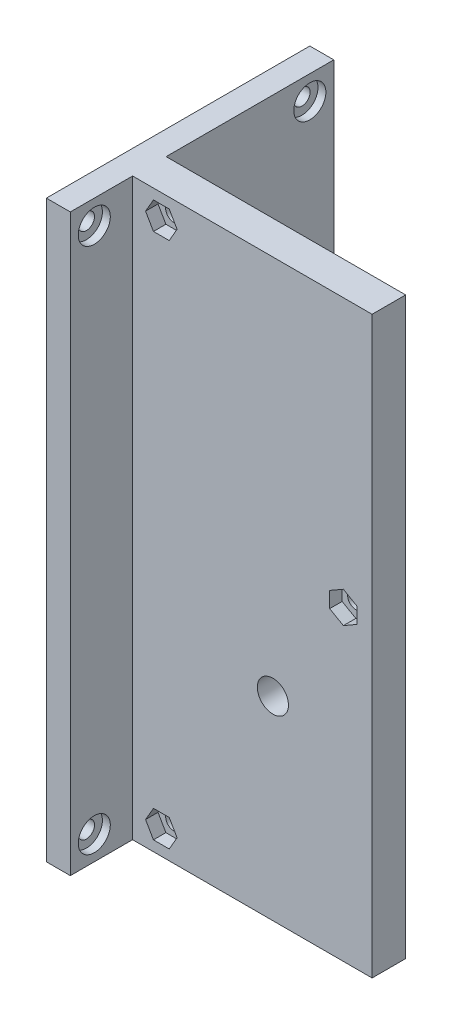
from build123d import *

# Parameters (mm, degrees)
SKETCH1_W                       = 120
SKETCH1_H                       = 55
BOSS_EXTRUDE1_DEPTH             = 5
BOSS_EXTRUDE2_DEPTH             = 5
BOSS_EXTRUDE2_DEPTH_BACK        = 2
SKETCH2_W                       = 50
SKETCH2_H                       = 120
SKETCH8_R                       = 1.7
CUT_EXTRUDE4_DEPTH              = 5
CBORE_FOR_M3_SBHCS1_D           = 3.4
CBORE_FOR_M3_SBHCS1_DEPTH       = 3.15
CBORE_FOR_M3_SBHCS1_CBORE_D     = 6.7
CBORE_FOR_M3_SBHCS1_CBORE_DEPTH = 1.65
CBORE_FOR_M3_SBHCS1_TIP         = 1.021463052
CBORE_FOR_M3_SBHCS2_D           = 3.4
CBORE_FOR_M3_SBHCS2_DEPTH       = 3.15
CBORE_FOR_M3_SBHCS2_CBORE_D     = 6.7
CBORE_FOR_M3_SBHCS2_CBORE_DEPTH = 1.65
CBORE_FOR_M3_SBHCS2_TIP         = 1.021463052
CBORE_FOR_M3_SBHCS3_D           = 3.4
CBORE_FOR_M3_SBHCS3_DEPTH       = 3.15
CBORE_FOR_M3_SBHCS3_CBORE_D     = 6.7
CBORE_FOR_M3_SBHCS3_CBORE_DEPTH = 1.65
CBORE_FOR_M3_SBHCS3_TIP         = 1.021463052
CBORE_FOR_M3_SBHCS4_D           = 3.4
CBORE_FOR_M3_SBHCS4_DEPTH       = 3.15
CBORE_FOR_M3_SBHCS4_CBORE_D     = 6.7
CBORE_FOR_M3_SBHCS4_CBORE_DEPTH = 1.65
CBORE_FOR_M3_SBHCS4_TIP         = 1.021463052
SKETCH13_R                      = 3.25
CUT_EXTRUDE5_DEPTH              = 7
SKETCH14_R                      = 1.7
CUT_EXTRUDE6_DEPTH              = 7
SKETCH16_R                      = 1.7
CUT_EXTRUDE8_DEPTH              = 7
CUT_EXTRUDE9_DEPTH              = 2.6


with BuildPart() as part:
    # Sketch1 → Boss-Extrude1 (new body)
    with BuildSketch(Plane.YZ):
        Rectangle(SKETCH1_W, SKETCH1_H)
    extrude(amount=BOSS_EXTRUDE1_DEPTH)

    # Sketch2 → Boss-Extrude2 (add, two sides: drawn at the far end of the back side and taken through both)
    with BuildSketch(Plane(origin=(0, 0, 12.5), x_dir=(-1, 0, 0), z_dir=(0, 0, -1)).offset(-BOSS_EXTRUDE2_DEPTH_BACK)):
        with Locations((-30, 0)):
            Rectangle(SKETCH2_W, SKETCH2_H)
    extrude(amount=BOSS_EXTRUDE2_DEPTH + BOSS_EXTRUDE2_DEPTH_BACK)

    # Sketch8 → Cut-Extrude4 (cut)
    with BuildSketch(Plane.YZ.offset(5)):
        with Locations((-55, 22.5)):
            Circle(SKETCH8_R)
        with Locations((-55, -22.5)):
            Circle(SKETCH8_R)
        with Locations((55, 22.5)):
            Circle(SKETCH8_R)
        with Locations((55, -22.5)):
            Circle(SKETCH8_R)
    extrude(amount=-CUT_EXTRUDE4_DEPTH, mode=Mode.SUBTRACT)

    # CBORE for M3 SBHCS1
    with Locations(Plane(origin=(5, 55, -22.5), x_dir=(0, 0, 1), z_dir=(1, 0, 0))):
        with Locations((0, 0)):
            CounterBoreHole(CBORE_FOR_M3_SBHCS1_D / 2, CBORE_FOR_M3_SBHCS1_CBORE_D / 2, CBORE_FOR_M3_SBHCS1_CBORE_DEPTH, depth=CBORE_FOR_M3_SBHCS1_DEPTH)
            with Locations((0, 0, -(CBORE_FOR_M3_SBHCS1_DEPTH + CBORE_FOR_M3_SBHCS1_TIP / 2))):  # 118° drill point
                Cone(0, CBORE_FOR_M3_SBHCS1_D / 2, CBORE_FOR_M3_SBHCS1_TIP, mode=Mode.SUBTRACT)

    # CBORE for M3 SBHCS2
    with Locations(Plane(origin=(5, 55, 22.5), x_dir=(0, 0, 1), z_dir=(1, 0, 0))):
        with Locations((0, 0)):
            CounterBoreHole(CBORE_FOR_M3_SBHCS2_D / 2, CBORE_FOR_M3_SBHCS2_CBORE_D / 2, CBORE_FOR_M3_SBHCS2_CBORE_DEPTH, depth=CBORE_FOR_M3_SBHCS2_DEPTH)
            with Locations((0, 0, -(CBORE_FOR_M3_SBHCS2_DEPTH + CBORE_FOR_M3_SBHCS2_TIP / 2))):  # 118° drill point
                Cone(0, CBORE_FOR_M3_SBHCS2_D / 2, CBORE_FOR_M3_SBHCS2_TIP, mode=Mode.SUBTRACT)

    # CBORE for M3 SBHCS3
    with Locations(Plane(origin=(5, -55, -22.5), x_dir=(0, 0, 1), z_dir=(1, 0, 0))):
        with Locations((0, 0)):
            CounterBoreHole(CBORE_FOR_M3_SBHCS3_D / 2, CBORE_FOR_M3_SBHCS3_CBORE_D / 2, CBORE_FOR_M3_SBHCS3_CBORE_DEPTH, depth=CBORE_FOR_M3_SBHCS3_DEPTH)
            with Locations((0, 0, -(CBORE_FOR_M3_SBHCS3_DEPTH + CBORE_FOR_M3_SBHCS3_TIP / 2))):  # 118° drill point
                Cone(0, CBORE_FOR_M3_SBHCS3_D / 2, CBORE_FOR_M3_SBHCS3_TIP, mode=Mode.SUBTRACT)

    # CBORE for M3 SBHCS4
    with Locations(Plane(origin=(5, -55, 22.5), x_dir=(0, 0, 1), z_dir=(1, 0, 0))):
        with Locations((0, 0)):
            CounterBoreHole(CBORE_FOR_M3_SBHCS4_D / 2, CBORE_FOR_M3_SBHCS4_CBORE_D / 2, CBORE_FOR_M3_SBHCS4_CBORE_DEPTH, depth=CBORE_FOR_M3_SBHCS4_DEPTH)
            with Locations((0, 0, -(CBORE_FOR_M3_SBHCS4_DEPTH + CBORE_FOR_M3_SBHCS4_TIP / 2))):  # 118° drill point
                Cone(0, CBORE_FOR_M3_SBHCS4_D / 2, CBORE_FOR_M3_SBHCS4_TIP, mode=Mode.SUBTRACT)

    # Sketch13 → Cut-Extrude5 (cut)
    with BuildSketch(Plane(origin=(0, 0, 7.5), x_dir=(1, 0, 0), z_dir=(0, 0, -1))):
        with Locations((34.29, 19.4)):
            Circle(SKETCH13_R)
    extrude(amount=-CUT_EXTRUDE5_DEPTH, mode=Mode.SUBTRACT)

    # Sketch14 → Cut-Extrude6 (cut)
    with BuildSketch(Plane(origin=(0, 0, 7.5), x_dir=(1, 0, 0), z_dir=(0, 0, -1))):
        with Locations((11, -55)):
            Circle(SKETCH14_R)
        with Locations((11, 55)):
            Circle(SKETCH14_R)
    extrude(amount=-CUT_EXTRUDE6_DEPTH, mode=Mode.SUBTRACT)

    # Sketch16 → Cut-Extrude8 (cut)
    with BuildSketch(Plane(origin=(0, 0, 7.5), x_dir=(1, 0, 0), z_dir=(0, 0, -1))):
        with Locations((49, -4)):
            Circle(SKETCH16_R)
    extrude(amount=-CUT_EXTRUDE8_DEPTH, mode=Mode.SUBTRACT)

    # Sketch17 → Cut-Extrude9 (cut)
    with BuildSketch(Plane.XY.offset(14.5)):
        Polygon((7.709103466, 55), (9.354551733, 52.15), (12.645448267, 52.15), (14.290896534, 55), (12.645448267, 57.85), (9.354551733, 57.85), align=None)
        Polygon((46.15, 2.354551733), (49, 0.709103466), (51.85, 2.354551733), (51.85, 5.645448267), (49, 7.290896534), (46.15, 5.645448267), align=None)
        Polygon((7.709108837, -54.9940543), (9.349405291, -57.847022499), (12.640296454, -57.852968198), (14.290891163, -55.0059457), (12.650594709, -52.152977501), (9.359703546, -52.147031802), align=None)
    extrude(amount=-CUT_EXTRUDE9_DEPTH, mode=Mode.SUBTRACT)


solid = part.part
